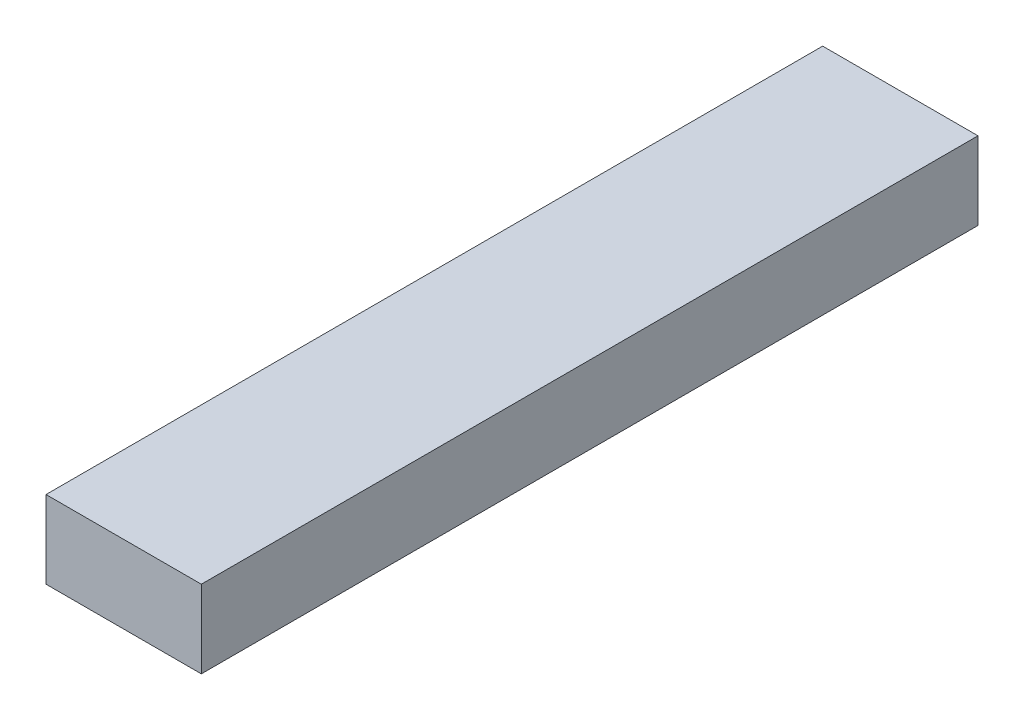
from build123d import *

# Parameters (mm, degrees)
SKETCH1_W           = 40
SKETCH1_H           = 20
BOSS_EXTRUDE1_DEPTH = 200


with BuildPart() as part:
    # Sketch1 → Boss-Extrude1 (new body)
    with BuildSketch(Plane.XY):
        with Locations((20, 10)):
            Rectangle(SKETCH1_W, SKETCH1_H)
    extrude(amount=BOSS_EXTRUDE1_DEPTH)


solid = part.part
